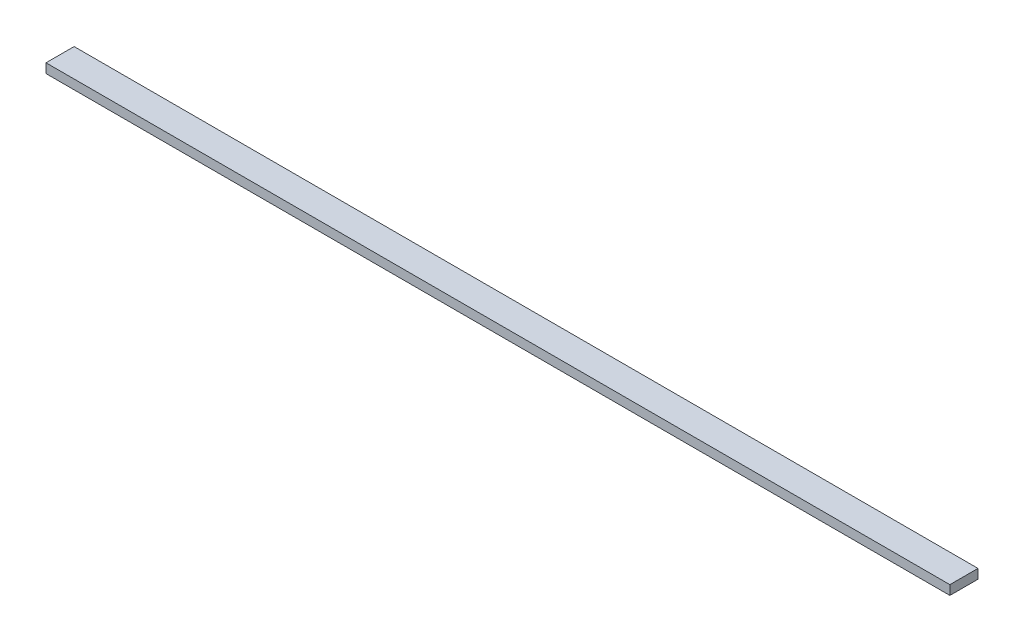
from build123d import *

# Parameters (mm, degrees)
SKETCH1_W           = 612.2797
SKETCH1_H           = 19.05
BOSS_EXTRUDE1_DEPTH = 6.35


with BuildPart() as part:
    # Sketch1 → Boss-Extrude1 (new body)
    with BuildSketch(Plane(origin=(0, 0, 0), x_dir=(1, 0, 0), z_dir=(0, 1, 0))):
        Rectangle(SKETCH1_W, SKETCH1_H)
    extrude(amount=BOSS_EXTRUDE1_DEPTH)


solid = part.part
